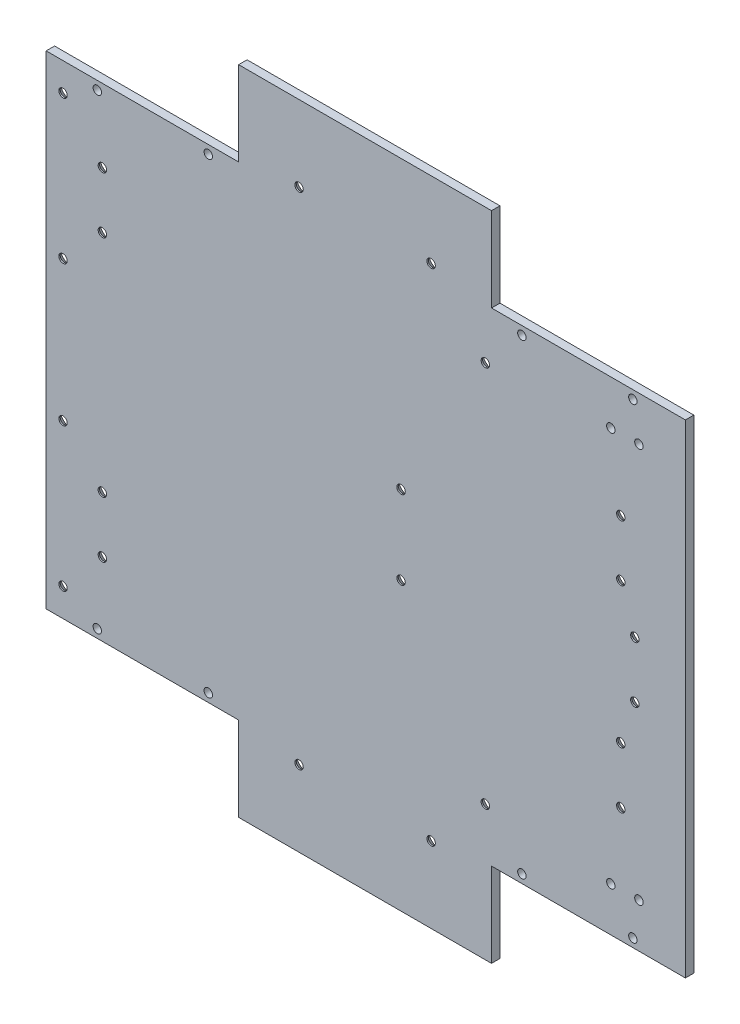
from build123d import *

# Parameters (mm, degrees)
EXTRUDE_1_DEPTH     = 3
SKETCH_2_R          = 1.5
CUT_EXTRUDE_1_DEPTH = 10
SKETCH_3_W          = 10
SKETCH_3_H          = 172
SKETCH_3_W_2        = 90
SKETCH_3_H_2        = 33
EXTRUDE_2_DEPTH     = 3
SKETCH_4_R          = 1.5
CUT_EXTRUDE_2_DEPTH = 10
SKETCH_5_R          = 1.5
CUT_EXTRUDE_3_DEPTH = 10
SKETCH_6_R          = 1.5
CUT_EXTRUDE_4_DEPTH = 10
SKETCH_7_R          = 1.5
CUT_EXTRUDE_5_DEPTH = 74
SKETCH_8_R          = 1.5
CUT_EXTRUDE_6_DEPTH = 10
SKETCH_9_W          = 6
SKETCH_9_H          = 172
EXTRUDE_3_DEPTH     = 3
SKETCH_10_R         = 1.5
CUT_EXTRUDE_7_DEPTH = 15
CHAMFER_2_SIZE      = 2.5
CHAMFER_3_SIZE      = 2.5
CHAMFER_4_SIZE      = 2.5
CHAMFER_5_SIZE      = 2.5
CHAMFER_6_SIZE      = 2.5
CHAMFER_7_SIZE      = 2.5
CHAMFER_8_SIZE      = 2.5
SKETCH_11_R         = 1.5
CUT_EXTRUDE_8_DEPTH = 10


with BuildPart() as part:
    # 草图1 → 凸台-拉伸1 (new body)
    with BuildSketch(Plane.XY):
        Polygon((-105.75, 86), (-105.75, 70), (-105.75, -86), (105.75, -86), (105.75, 86), align=None)
    extrude(amount=EXTRUDE_1_DEPTH)

    # 草图2 → 切除-拉伸1 (cut)
    with BuildSketch(Plane.XY.offset(3)):
        with Locations((97.05, 83)):
            Circle(SKETCH_2_R)
        with Locations((-93.55, 83)):
            Circle(SKETCH_2_R)
        with Locations((57.55, 83)):
            Circle(SKETCH_2_R)
        with Locations((-54.05, 83)):
            Circle(SKETCH_2_R)
        with Locations((57.55, -83)):
            Circle(SKETCH_2_R)
        with Locations((97.05, -83)):
            Circle(SKETCH_2_R)
        with Locations((-54.05, -83)):
            Circle(SKETCH_2_R)
        with Locations((-93.55, -83)):
            Circle(SKETCH_2_R)
    extrude(amount=-CUT_EXTRUDE_1_DEPTH, mode=Mode.SUBTRACT)

    # 草图3 → 凸台-拉伸2 (add)
    with BuildSketch(Plane.XY.offset(3)):
        with Locations((110.75, 0)):
            Rectangle(SKETCH_3_W, SKETCH_3_H)
        with Locations((1.75, 99.5)):
            Rectangle(SKETCH_3_W_2, SKETCH_3_H_2)
        with Locations((1.75, -99.5)):
            Rectangle(SKETCH_3_W_2, SKETCH_3_H_2)
    extrude(amount=-EXTRUDE_2_DEPTH)

    # 草图4 → 切除-拉伸2 (cut)
    with BuildSketch(Plane.XY.offset(3)):
        with Locations((44.55, 68)):
            Circle(SKETCH_4_R)
        with Locations((14.55, -14)):
            Circle(SKETCH_4_R)
        with Locations((14.55, 14)):
            Circle(SKETCH_4_R)
        with Locations((44.55, -68)):
            Circle(SKETCH_4_R)
    extrude(amount=-CUT_EXTRUDE_2_DEPTH, mode=Mode.SUBTRACT)

    # 草图5 → 切除-拉伸3 (cut)
    with BuildSketch(Plane.XY.offset(3)):
        with Locations((92.75, 45)):
            Circle(SKETCH_5_R)
        with Locations((92.75, 25)):
            Circle(SKETCH_5_R)
        with Locations((92.75, -25)):
            Circle(SKETCH_5_R)
        with Locations((92.75, -45)):
            Circle(SKETCH_5_R)
    extrude(amount=-CUT_EXTRUDE_3_DEPTH, mode=Mode.SUBTRACT)

    # 草图6 → 切除-拉伸4 (cut)
    with BuildSketch(Plane.XY.offset(3)):
        with Locations((25.25, -89)):
            Circle(SKETCH_6_R)
        with Locations((-21.75, 89)):
            Circle(SKETCH_6_R)
        with Locations((25.25, 89)):
            Circle(SKETCH_6_R)
        with Locations((-21.75, -89)):
            Circle(SKETCH_6_R)
    extrude(amount=-CUT_EXTRUDE_4_DEPTH, mode=Mode.SUBTRACT)

    # 草图7 → 切除-拉伸5 (cut)
    with BuildSketch(Plane(origin=(0, 0, 0), x_dir=(-1, 0, 0), z_dir=(0, 0, -1))):
        with Locations((91.75, -60)):
            Circle(SKETCH_7_R)
        with Locations((91.75, -40)):
            Circle(SKETCH_7_R)
        with Locations((91.75, 60)):
            Circle(SKETCH_7_R)
        with Locations((91.75, 40)):
            Circle(SKETCH_7_R)
    extrude(amount=-CUT_EXTRUDE_5_DEPTH, mode=Mode.SUBTRACT)

    # 草图8 → 切除-拉伸6 (cut)
    with BuildSketch(Plane(origin=(0, 0, 0), x_dir=(-1, 0, 0), z_dir=(0, 0, -1))):
        with Locations((-97.75, 10)):
            Circle(SKETCH_8_R)
        with Locations((-97.75, -10)):
            Circle(SKETCH_8_R)
    extrude(amount=-CUT_EXTRUDE_6_DEPTH, mode=Mode.SUBTRACT)

    # 草图9 → 凸台-拉伸3 (add)
    with BuildSketch(Plane(origin=(0, 0, 0), x_dir=(-1, 0, 0), z_dir=(0, 0, -1))):
        with Locations((108.75, 0)):
            Rectangle(SKETCH_9_W, SKETCH_9_H)
    extrude(amount=-EXTRUDE_3_DEPTH)

    # 草图10 → 切除-拉伸7 (cut)
    with BuildSketch(Plane(origin=(0, 0, 0), x_dir=(-1, 0, 0), z_dir=(0, 0, -1))):
        with Locations((105.75, 76)):
            Circle(SKETCH_10_R)
        with Locations((105.75, 25)):
            Circle(SKETCH_10_R)
        with Locations((105.75, -25)):
            Circle(SKETCH_10_R)
        with Locations((105.75, -76)):
            Circle(SKETCH_10_R)
    extrude(amount=-CUT_EXTRUDE_7_DEPTH, mode=Mode.SUBTRACT)

    # 倒角2
    chamfer_2_edges = [part.edges().sort_by_distance(p)[0] for p in [
        (23.75, 89, 0),
    ]]
    chamfer(chamfer_2_edges, length=CHAMFER_2_SIZE)

    # 倒角3
    chamfer_3_edges = [part.edges().sort_by_distance(p)[0] for p in [
        (-23.25, 89, 0),
        (-90.25, -60, 0),
        (-90.25, -40, 0),
        (-90.25, 60, 0),
        (-90.25, 40, 0),
        (-104.25, 76, 0),
        (-104.25, 25, 0),
        (-104.25, -25, 0),
        (-104.25, -76, 0),
    ]]
    chamfer(chamfer_3_edges, length=CHAMFER_3_SIZE)

    # 倒角4
    chamfer_4_edges = [part.edges().sort_by_distance(p)[0] for p in [
        (43.05, -68, 0),
        (23.75, -89, 0),
        (-23.25, -89, 0),
    ]]
    chamfer(chamfer_4_edges, length=CHAMFER_4_SIZE)

    # 倒角5
    chamfer_5_edges = [part.edges().sort_by_distance(p)[0] for p in [
        (91.25, 45, 0),
        (91.25, 25, 0),
        (91.25, -25, 0),
        (91.25, -45, 0),
        (99.25, 10, 0),
        (99.25, -10, 0),
    ]]
    chamfer(chamfer_5_edges, length=CHAMFER_5_SIZE)

    # 倒角6
    chamfer_6_edges = [part.edges().sort_by_distance(p)[0] for p in [
        (13.05, 14, 0),
    ]]
    chamfer(chamfer_6_edges, length=CHAMFER_6_SIZE)

    # 倒角7
    chamfer_7_edges = [part.edges().sort_by_distance(p)[0] for p in [
        (43.05, 68, 0),
    ]]
    chamfer(chamfer_7_edges, length=CHAMFER_7_SIZE)

    # 倒角8
    chamfer_8_edges = [part.edges().sort_by_distance(p)[0] for p in [
        (13.05, -14, 0),
    ]]
    chamfer(chamfer_8_edges, length=CHAMFER_8_SIZE)

    # 草图11 → 切除-拉伸8 (cut)
    with BuildSketch(Plane(origin=(0, 0, 0), x_dir=(-1, 0, 0), z_dir=(0, 0, -1))):
        with Locations((-89.209242617, 70.25)):
            Circle(SKETCH_11_R)
        with Locations((-99.209242617, 70.25)):
            Circle(SKETCH_11_R)
    cut_extrude_8 = extrude(amount=-CUT_EXTRUDE_8_DEPTH, mode=Mode.SUBTRACT)

    # 镜向1: 切除-拉伸8 across plane
    add(cut_extrude_8.mirror(Plane.ZX), mode=Mode.SUBTRACT)


solid = part.part
